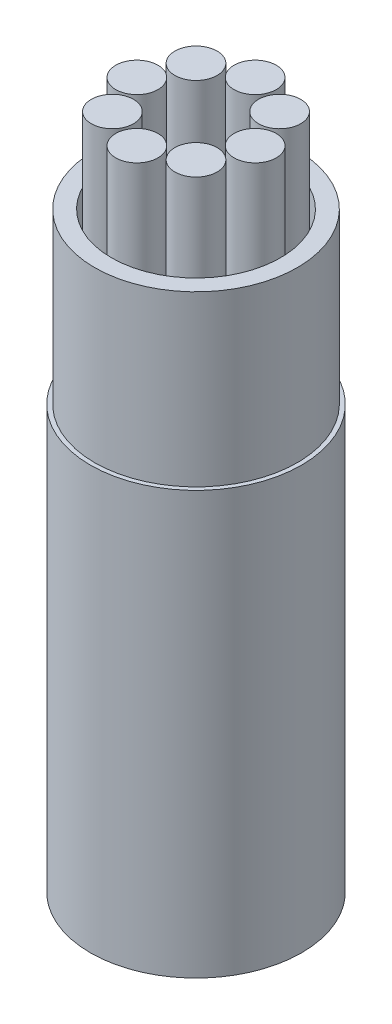
from build123d import *

# Parameters (mm, degrees)
MAINWIRES_R       = 2.5
MAINWIRE_DEPTH    = 10
VCCS_R            = 0.5
VCC_DEPTH         = 6
GROUNDS_R         = 0.5
GROUND_DEPTH      = 6
AS_2_R            = 0.5
EXTRUDE_A_DEPTH   = 6
BS_R              = 0.5
EXTRUDE_B_DEPTH   = 6
ZS_R              = 0.5
EXTRUDE_Z_DEPTH   = 6
A_S_R             = 0.5
EXTRUDE_A_2_DEPTH = 6
B_S_R             = 0.5
EXTRUDE_B_2_DEPTH = 6
Z_S_R             = 0.5
EXTRUDE_Z_2_DEPTH = 6
SHIELDINGS_R      = 2.4
SHIELDINGS_R_2    = 2
SHIELDING_DEPTH   = 4


with BuildPart() as part:
    # MainWireS → MainWire (new body)
    with BuildSketch(Plane(origin=(0, 0, 0), x_dir=(1, 0, 0), z_dir=(0, 1, 0))):
        with Locations(Location((0, 0, 0), (0, 0, 270))):
            Circle(MAINWIRES_R)
    extrude(amount=MAINWIRE_DEPTH)

    # VccS → Vcc (add)
    with BuildSketch(Plane(origin=(0, 10, 0), x_dir=(1, 0, 0), z_dir=(0, 1, 0))):
        with Locations(Location((0, 1.4, 0), (0, 0, 270))):
            Circle(VCCS_R)
    extrude(amount=VCC_DEPTH)

    # GroundS → Ground (add)
    with BuildSketch(Plane(origin=(0, 10, 0), x_dir=(1, 0, 0), z_dir=(0, 1, 0))):
        with Locations(Location((0.989949494, 0.989949494, 0), (0, 0, 270))):
            Circle(GROUNDS_R)
    extrude(amount=GROUND_DEPTH)

    # AS 2 → Extrude A (add)
    with BuildSketch(Plane(origin=(0, 10, 0), x_dir=(1, 0, 0), z_dir=(0, 1, 0))):
        with Locations(Location((1.4, 0, 0), (0, 0, 270))):
            Circle(AS_2_R)
    extrude(amount=EXTRUDE_A_DEPTH)

    # BS → Extrude B (add)
    with BuildSketch(Plane(origin=(0, 10, 0), x_dir=(1, 0, 0), z_dir=(0, 1, 0))):
        with Locations(Location((0.989949494, -0.989949494, 0), (0, 0, 270))):
            Circle(BS_R)
    extrude(amount=EXTRUDE_B_DEPTH)

    # ZS → Extrude Z (add)
    with BuildSketch(Plane(origin=(0, 10, 0), x_dir=(1, 0, 0), z_dir=(0, 1, 0))):
        with Locations(Location((0, -1.4, 0), (0, 0, 270))):
            Circle(ZS_R)
    extrude(amount=EXTRUDE_Z_DEPTH)

    # A-S → Extrude A 2 (add)
    with BuildSketch(Plane(origin=(0, 10, 0), x_dir=(1, 0, 0), z_dir=(0, 1, 0))):
        with Locations(Location((-0.989949494, -0.989949494, 0), (0, 0, 270))):
            Circle(A_S_R)
    extrude(amount=EXTRUDE_A_2_DEPTH)

    # B-S → Extrude B 2 (add)
    with BuildSketch(Plane(origin=(0, 10, 0), x_dir=(1, 0, 0), z_dir=(0, 1, 0))):
        with Locations(Location((-1.4, 0, 0), (0, 0, 270))):
            Circle(B_S_R)
    extrude(amount=EXTRUDE_B_2_DEPTH)

    # Z-S → Extrude Z 2 (add)
    with BuildSketch(Plane(origin=(0, 10, 0), x_dir=(1, 0, 0), z_dir=(0, 1, 0))):
        with Locations(Location((-0.989949494, 0.989949494, 0), (0, 0, 270))):
            Circle(Z_S_R)
    extrude(amount=EXTRUDE_Z_2_DEPTH)

    # ShieldingS → Shielding (add)
    with BuildSketch(Plane(origin=(0, 10, 0), x_dir=(1, 0, 0), z_dir=(0, 1, 0))):
        with Locations(Location((0, 0, 0), (0, 0, 270))):
            Circle(SHIELDINGS_R)
        with Locations(Location((0, 0, 0), (0, 0, 270))):
            Circle(SHIELDINGS_R_2, mode=Mode.SUBTRACT)
    extrude(amount=SHIELDING_DEPTH)


solid = part.part
